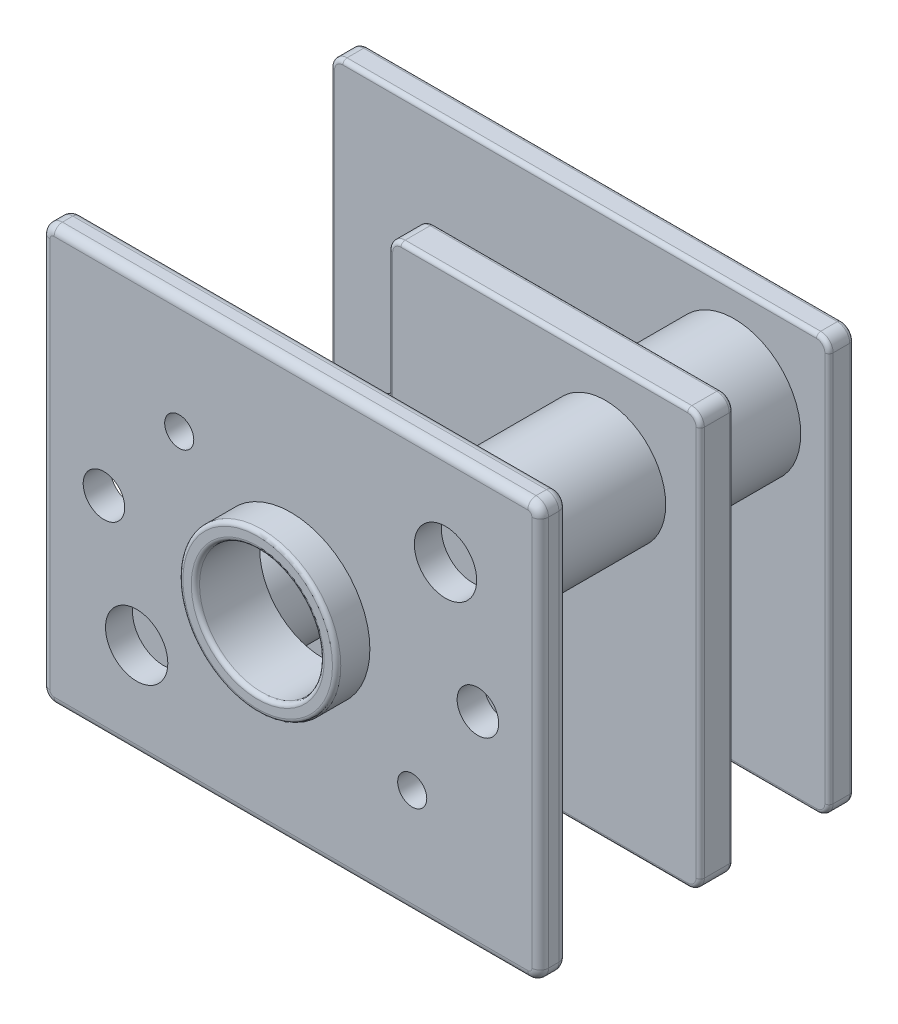
from build123d import *

# Parameters (mm, degrees)
BOSS_EXTRUDE1_DEPTH = 0.6
FILLET1_R           = 0.3
FILLET2_R           = 0.1
SKETCH2_R           = 1.6
BOSS_EXTRUDE2_DEPTH = 2.3
BOSS_EXTRUDE3_DEPTH = 0.8
FILLET3_R           = 0.3
FILLET4_R           = 0.1
SKETCH4_R           = 1.45
BOSS_EXTRUDE4_DEPTH = 3.2
SKETCH5_W           = 12
SKETCH5_H           = 10
SKETCH5_R           = 0.75
SKETCH5_R_2         = 0.5
SKETCH5_R_3         = 0.35
SKETCH5_R_4         = 1.5
BOSS_EXTRUDE5_DEPTH = 0.65
FILLET5_R           = 0.3
FILLET6_R           = 0.2
SKETCH6_R           = 1.9
SKETCH6_R_2         = 1.5
BOSS_EXTRUDE6_DEPTH = 0.8
FILLET7_R           = 0.1
BOSS_EXTRUDE7_START = 0.1
SKETCH7_R           = 1.9
SKETCH7_R_2         = 1.5
BOSS_EXTRUDE7_DEPTH = 0.1


with BuildPart() as part:
    # Sketch1 → Boss-Extrude1 (new body)
    with BuildSketch(Plane.XY):
        with BuildLine():
            Line((0.369004191, -5), (6, -5))
            Line((6, -5), (6, 5))
            Line((6, 5), (-6, 5))
            Line((-6, 5), (-6, -5))
            Line((-6, -5), (-0.369004191, -5))
            ThreePointArc((-0.369004191, -5), (0, -4.630995809), (0.369004191, -5))
        make_face()
    extrude(amount=BOSS_EXTRUDE1_DEPTH)

    # Fillet1
    fillet1_edges = [part.edges().sort_by_distance(p)[0] for p in [
        (6, -5, 0.3),
        (-6, -5, 0.3),
        (-6, 5, 0.3),
        (6, 5, 0.3),
    ]]
    fillet(fillet1_edges, radius=FILLET1_R)

    # Fillet2
    fillet2_edges = [part.edges().sort_by_distance(p)[0] for p in [
        (0, -4.630995809, 0.6),
        (-6, 0, 0),
        (3.034502095, -5, 0.6),
        (-6, 0, 0.6),
        (6, 0, 0),
        (-3.034502095, -5, 0),
        (0, 5, 0),
        (-5.912132034, -4.912132034, 0),
        (5.912132034, -4.912132034, 0),
        (5.912132034, 4.912132034, 0),
        (-5.912132034, 4.912132034, 0),
        (0, 5, 0.6),
        (6, 0, 0.6),
        (-3.034502095, -5, 0.6),
        (-5.912132034, -4.912132034, 0.6),
        (5.912132034, -4.912132034, 0.6),
        (5.912132034, 4.912132034, 0.6),
        (-5.912132034, 4.912132034, 0.6),
        (3.034502095, -5, 0),
        (0, -4.630995809, 0),
    ]]
    fillet(fillet2_edges, radius=FILLET2_R)

    # Sketch2 → Boss-Extrude2 (add)
    with BuildSketch(Plane.XY.offset(0.6)):
        with Locations((-3.713308082, -2.726915766)):
            Circle(SKETCH2_R)
        with Locations((3.720101013, 2.720101013)):
            Circle(SKETCH2_R)
    extrude(amount=BOSS_EXTRUDE2_DEPTH)

    # Sketch3 → Boss-Extrude3 (add)
    with BuildSketch(Plane.XY.offset(2.9)):
        Polygon((-6, -5), (6, -5), (6, 5), (-1.5, 5), (-1.5, 0.3), (-6, 0.3), align=None)
    extrude(amount=BOSS_EXTRUDE3_DEPTH)

    # Fillet3
    fillet3_edges = [part.edges().sort_by_distance(p)[0] for p in [
        (6, -5, 3.3),
        (6, 5, 3.3),
        (-1.5, 5, 3.3),
        (-1.5, 0.3, 3.3),
        (-6, 0.3, 3.3),
        (-6, -5, 3.3),
    ]]
    fillet(fillet3_edges, radius=FILLET3_R)

    # Fillet4
    fillet4_edges = [part.edges().sort_by_distance(p)[0] for p in [
        (2.25, 5, 2.9),
        (2.25, 5, 3.7),
        (6, 0, 2.9),
        (0, -5, 2.9),
        (-6, -2.35, 2.9),
        (-3.75, 0.3, 2.9),
        (-1.5, 2.65, 2.9),
        (-1.412132034, 4.912132034, 2.9),
        (-5.912132034, 0.212132034, 2.9),
        (-5.912132034, -4.912132034, 2.9),
        (5.912132034, -4.912132034, 2.9),
        (5.912132034, 4.912132034, 2.9),
        (6, 0, 3.7),
        (-1.5, 2.65, 3.7),
        (-3.75, 0.3, 3.7),
        (-6, -2.35, 3.7),
        (0, -5, 3.7),
        (-1.412132034, 4.912132034, 3.7),
        (-5.912132034, 0.212132034, 3.7),
        (-5.912132034, -4.912132034, 3.7),
        (5.912132034, -4.912132034, 3.7),
        (5.912132034, 4.912132034, 3.7),
        (-1.587867966, 0.387867966, 2.9),
        (-1.587867966, 0.387867966, 3.7),
    ]]
    fillet(fillet4_edges, radius=FILLET4_R)

    # Sketch4 → Boss-Extrude4 (add)
    with BuildSketch(Plane.XY.offset(3.7)):
        with Locations((3.720101013, 2.720101013)):
            Circle(SKETCH4_R)
        with Locations((-3.713308082, -2.726915766)):
            Circle(SKETCH4_R)
    extrude(amount=BOSS_EXTRUDE4_DEPTH)

    # Sketch5 → Boss-Extrude5 (add)
    with BuildSketch(Plane.XY.offset(6.9)):
        Rectangle(SKETCH5_W, SKETCH5_H)
        with Locations((3.720101013, 2.720101013)):
            Circle(SKETCH5_R, mode=Mode.SUBTRACT)
        with Locations((-3.713308082, -2.726915766)):
            Circle(SKETCH5_R, mode=Mode.SUBTRACT)
        with Locations((4.5, 0)):
            Circle(SKETCH5_R_2, mode=Mode.SUBTRACT)
        with Locations((-4.5, 0)):
            Circle(SKETCH5_R_2, mode=Mode.SUBTRACT)
        with Locations((2.919240862, -2.432700719)):
            Circle(SKETCH5_R_3, mode=Mode.SUBTRACT)
        with Locations((-2.688774479, 2.240645399)):
            Circle(SKETCH5_R_3, mode=Mode.SUBTRACT)
        Circle(SKETCH5_R_4, mode=Mode.SUBTRACT)
    extrude(amount=BOSS_EXTRUDE5_DEPTH)

    # Fillet5
    fillet5_edges = [part.edges().sort_by_distance(p)[0] for p in [
        (6, -5, 7.225),
        (6, 5, 7.225),
        (-6, 5, 7.225),
        (-6, -5, 7.225),
    ]]
    fillet(fillet5_edges, radius=FILLET5_R)

    # Fillet6
    fillet6_edges = [part.edges().sort_by_distance(p)[0] for p in [
        (6, 0, 6.9),
        (6, 0, 7.55),
        (0, -5, 6.9),
        (-6, 0, 6.9),
        (0, 5, 6.9),
        (5.912132034, 4.912132034, 6.9),
        (-5.912132034, 4.912132034, 6.9),
        (-5.912132034, -4.912132034, 6.9),
        (5.912132034, -4.912132034, 6.9),
        (0, -5, 7.55),
        (0, 5, 7.55),
        (-6, 0, 7.55),
        (5.912132034, 4.912132034, 7.55),
        (-5.912132034, 4.912132034, 7.55),
        (-5.912132034, -4.912132034, 7.55),
        (5.912132034, -4.912132034, 7.55),
    ]]
    fillet(fillet6_edges, radius=FILLET6_R)

    # Sketch6 → Boss-Extrude6 (add)
    with BuildSketch(Plane.XY.offset(7.55)):
        Circle(SKETCH6_R)
        Circle(SKETCH6_R_2, mode=Mode.SUBTRACT)
    extrude(amount=BOSS_EXTRUDE6_DEPTH)

    # Fillet7
    fillet7_edges = [part.edges().sort_by_distance(p)[0] for p in [
        (-1.9, 0, 8.35),
        (-1.5, 0, 8.35),
    ]]
    fillet(fillet7_edges, radius=FILLET7_R)

    # Sketch7 → Boss-Extrude7 (add)
    with BuildSketch(Plane(origin=(0, 0, 6.9), x_dir=(-1, 0, 0), z_dir=(0, 0, -1)).offset(BOSS_EXTRUDE7_START)):
        with Locations(Location((0, 0, 0), (0, 0, 180))):
            Circle(SKETCH7_R)
        Circle(SKETCH7_R_2, mode=Mode.SUBTRACT)
    extrude(amount=-BOSS_EXTRUDE7_DEPTH)


solid = part.part
